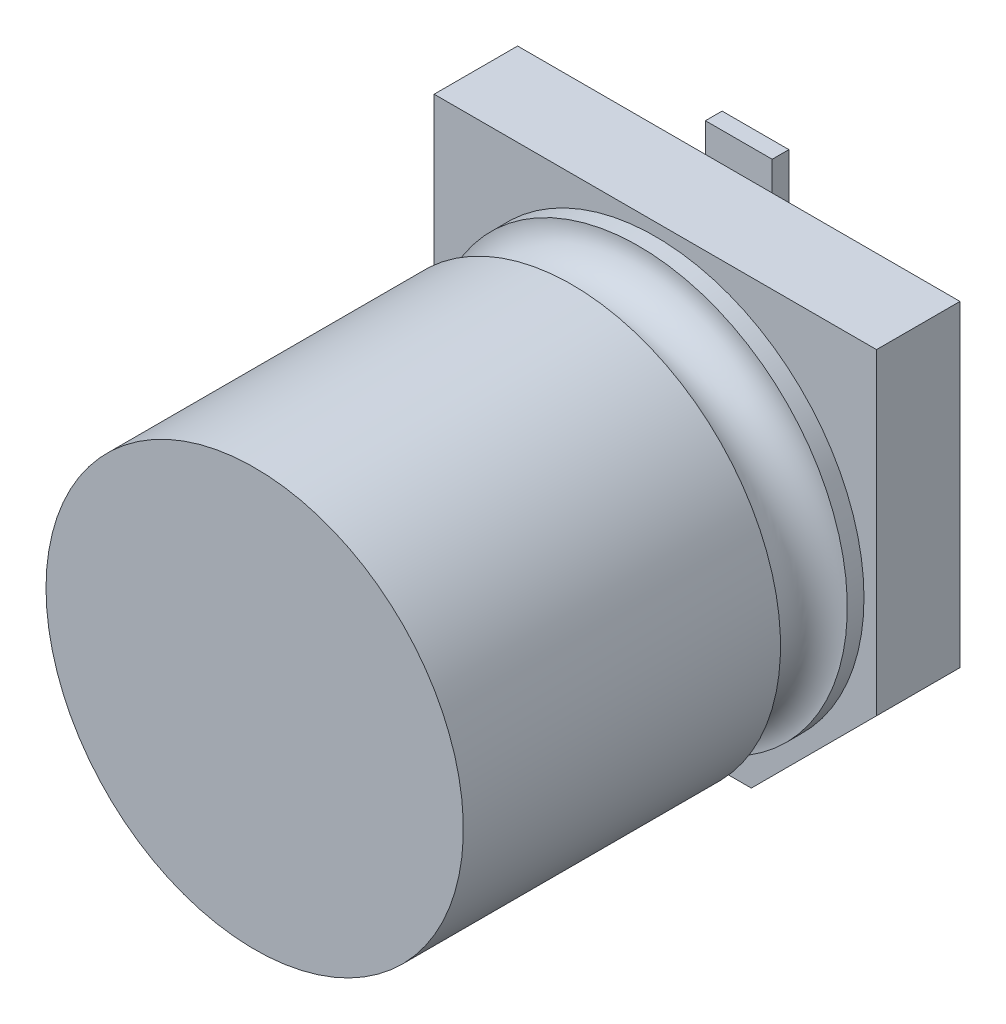
from build123d import *

# Parameters (mm, degrees)
BOSS_EXTRUDE1_START = 0.2
BOSS_EXTRUDE1_DEPTH = 1
BOSS_EXTRUDE2_DEPTH = 0.2


with BuildPart() as part:
    # Sketch1 → Boss-Extrude1 (new body)
    with BuildSketch(Plane.XY.offset(BOSS_EXTRUDE1_START)):
        Polygon((-2.65, 2.65), (2.65, 2.65), (2.65, -1.15), (1.15, -2.65), (-1.15, -2.65), (-2.65, -1.15), align=None)
    extrude(amount=BOSS_EXTRUDE1_DEPTH)

    # Sketch2 → Revolve1 (revolve)
    with BuildSketch(Plane(origin=(0, 0, 0), x_dir=(0, 0, -1), z_dir=(1, 0, 0)), mode=Mode.PRIVATE) as revolve1_sk:
        with BuildLine():
            Line((-6, 0), (-6, 2.5))
            Line((-6, 2.5), (-2.2, 2.5))
            ThreePointArc((-2.2, 2.5), (-1.8, 2.1), (-1.4, 2.5))
            Line((-1.4, 2.5), (-1.2, 2.5))
            Line((-1.2, 2.5), (-1.2, 0))
            Line((-1.2, 0), (-6, 0))
        make_face()
    revolve(revolve1_sk.sketch.rotate(Axis((0, 0, 0), (0, 0, 1)), 90), axis=Axis((0, 0, 0), (0, 0, 1)))

    # Sketch3 → Boss-Extrude2 (add)
    with BuildSketch(Plane.XY):
        with BuildLine():
            Line((0.4, -1.1), (0.4, -3))
            Line((0.4, -3), (-0.4, -3))
            Line((-0.4, -3), (-0.4, -1.1))
            ThreePointArc((-0.4, -1.1), (0, -0.7), (0.4, -1.1))
        make_face()
    boss_extrude2 = extrude(amount=BOSS_EXTRUDE2_DEPTH)

    # Mirror1: Boss-Extrude2 across plane
    add(boss_extrude2.mirror(Plane.ZX))


solid = part.part
